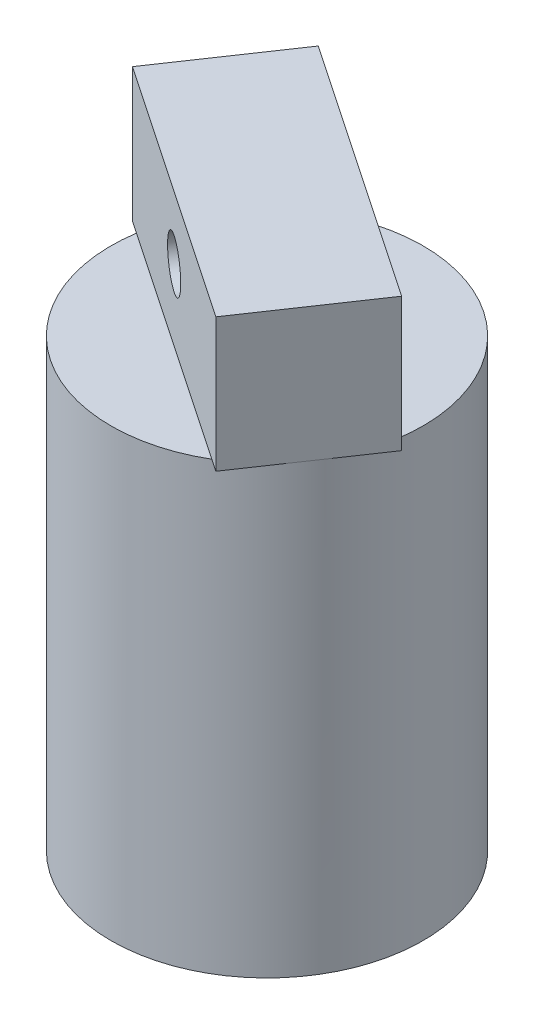
from build123d import *

# Parameters (mm, degrees)
SKETCH_1_R           = 3.5
EXTRUDE_2_DEPTH      = 10
SKETCH_2_R           = 1.6
CUT_EXTRUDE_1_DEPTH  = 7
EXTRUDE_4_DEPTH      = 1.5
EXTRUDE_4_DEPTH_BACK = 1.5
SKETCH_3_W           = 7
SKETCH_3_H           = 3
SKETCH_3_R           = 0.54827979


with BuildPart() as part:
    # Эскиз1 → Бобышка-Вытянуть2 (new body)
    with BuildSketch(Plane(origin=(0, 0, 0), x_dir=(1, 0, 0), z_dir=(0, 1, 0))):
        Circle(SKETCH_1_R)
    extrude(amount=EXTRUDE_2_DEPTH)

    # Эскиз2 → Вырез-Вытянуть1 (cut)
    with BuildSketch(Plane.XZ):
        Circle(SKETCH_2_R)
    extrude(amount=-CUT_EXTRUDE_1_DEPTH, mode=Mode.SUBTRACT)

    # Эскиз3 → Бобышка-Вытянуть4 (add, two sides: drawn at the far end of the back side and taken through both)
    with BuildSketch(Plane(origin=(0, 0, 0), x_dir=(0.8279714138688067, 0, 0.5607703075378451), z_dir=(-0.5607703075378451, 0, 0.8279714138688067)).offset(-EXTRUDE_4_DEPTH_BACK)):
        with Locations((0, 11.5)):
            Rectangle(SKETCH_3_W, SKETCH_3_H)
        with Locations((0, 11.597681641)):
            Circle(SKETCH_3_R, mode=Mode.SUBTRACT)
    extrude(amount=EXTRUDE_4_DEPTH + EXTRUDE_4_DEPTH_BACK)


solid = part.part
